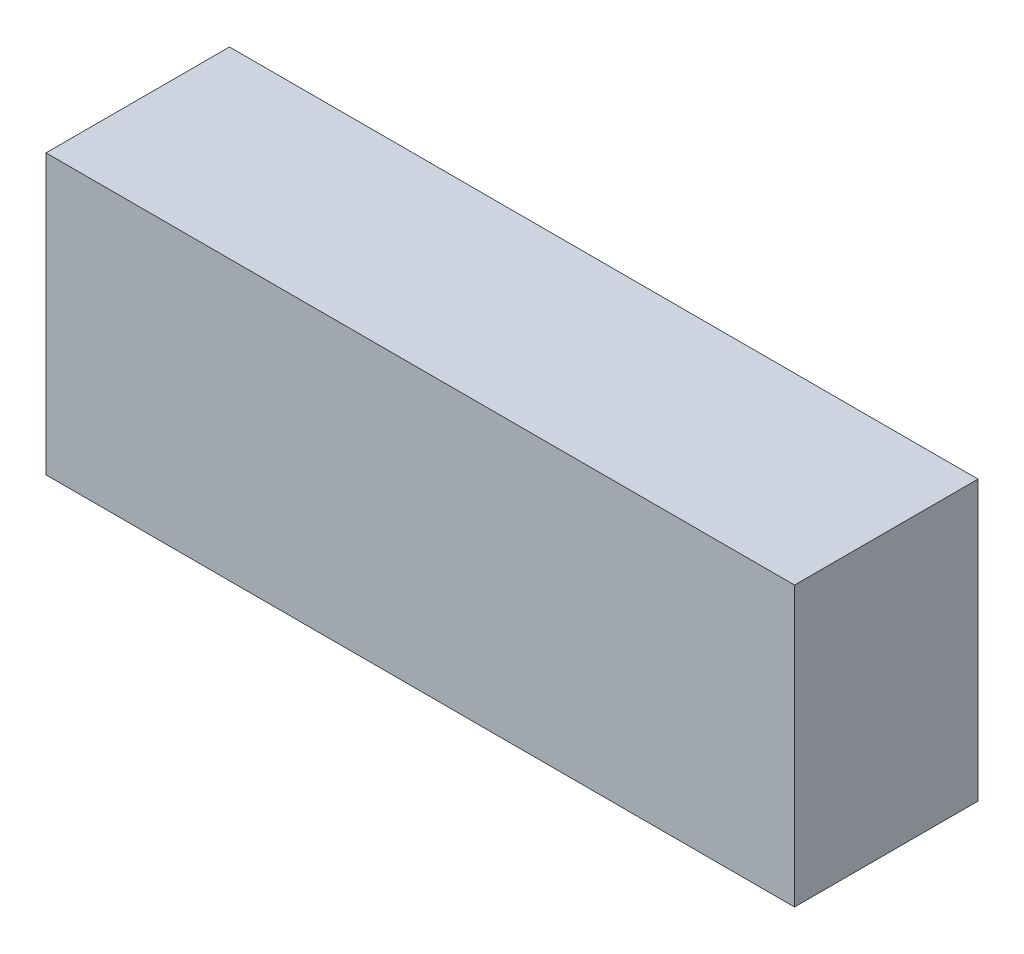
from build123d import *

# Parameters (mm, degrees)
SKETCH1_W                       = 102
SKETCH1_H                       = 38
BOSS_EXTRUDE1_DEPTH             = 25
SKETCH2_R                       = 3
CUT_EXTRUDE1_DEPTH              = 60
M4X0_7_TAPPED_HOLE1_D           = 3.3
M4X0_7_TAPPED_HOLE1_DEPTH       = 8.1
M4X0_7_TAPPED_HOLE1_CSINK_D     = 4.05
M4X0_7_TAPPED_HOLE1_CSINK_ANGLE = 100
M4X0_7_TAPPED_HOLE1_TIP         = 0.991420021


with BuildPart() as part:
    # Sketch1 → Boss-Extrude1 (new body)
    with BuildSketch(Plane.XY):
        with Locations((51, 19)):
            Rectangle(SKETCH1_W, SKETCH1_H)
    extrude(amount=BOSS_EXTRUDE1_DEPTH)

    # Sketch2 → Cut-Extrude1 (cut)
    with BuildSketch(Plane.ZY):
        with Locations((12.5, 19)):
            Circle(SKETCH2_R)
    extrude(amount=-CUT_EXTRUDE1_DEPTH, mode=Mode.SUBTRACT)

    # M4x0.7 Tapped Hole1
    with Locations(Plane(origin=(0, 0, 0), x_dir=(-1, 0, 0), z_dir=(0, -1, 0))):
        with Locations((-82, -4), (-12, -4), (-12, -21), (-82, -21)):
            CounterSinkHole(M4X0_7_TAPPED_HOLE1_D / 2, M4X0_7_TAPPED_HOLE1_CSINK_D / 2, depth=M4X0_7_TAPPED_HOLE1_DEPTH, counter_sink_angle=M4X0_7_TAPPED_HOLE1_CSINK_ANGLE)
            with Locations((0, 0, -(M4X0_7_TAPPED_HOLE1_DEPTH + M4X0_7_TAPPED_HOLE1_TIP / 2))):  # 118° drill point
                Cone(0, M4X0_7_TAPPED_HOLE1_D / 2, M4X0_7_TAPPED_HOLE1_TIP, mode=Mode.SUBTRACT)


solid = part.part
